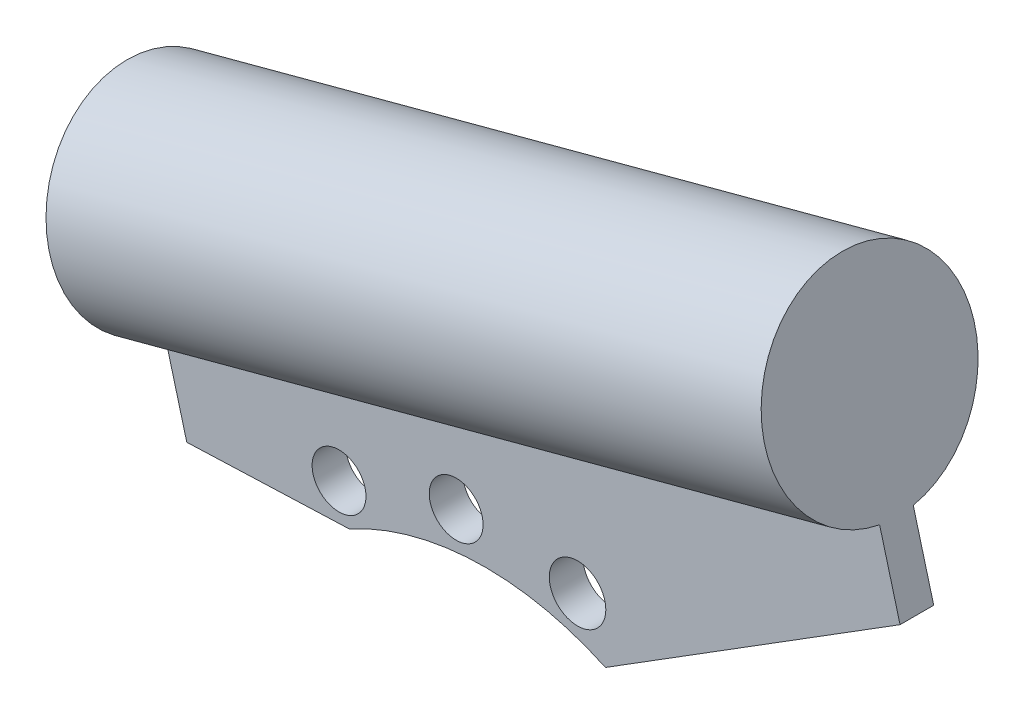
from build123d import *

# Parameters (mm, degrees)
SKETCH1_R           = 4
SKETCH1_R_2         = 4.198873956
BOSS_EXTRUDE1_DEPTH = 5
SKETCH2_R           = 13.5
BOSS_EXTRUDE2_DEPTH = 106
BOSS_EXTRUDE4_DEPTH = 4
CUT_EXTRUDE1_START  = -10
CUT_EXTRUDE1_DEPTH  = 10


with BuildPart() as part:
    # Sketch1 → Boss-Extrude1 (new body)
    with BuildSketch(Plane.XY.offset(32.670544835)):
        with BuildLine():
            Line((-70.496842865, 21.117824566), (-77.080259334, 45.687469315))
            Line((-77.080259334, 45.687469315), (29.171581558, 74.157564276))
            Line((29.171581558, 74.157564276), (32.157340999, 63.014558343))
            Line((32.157340999, 63.014558343), (-11.6122935, 35.626592223))
            ThreePointArc((-11.6122935, 35.626592223), (-40.615747818, 38.096615543), (-64.259394629, 21.117824566))
            Line((-64.259394629, 21.117824566), (-70.496842865, 21.117824566))
        make_face()
        with Locations((-65.433540443, 28.621355152)):
            Circle(SKETCH1_R, mode=Mode.SUBTRACT)
        with Locations((-51.195341682, 39.839935825)):
            Circle(SKETCH1_R, mode=Mode.SUBTRACT)
        with Locations((-33.791359384, 44.907899562)):
            Circle(SKETCH1_R, mode=Mode.SUBTRACT)
        with Locations((-15.756175362, 43.087187195)):
            Circle(SKETCH1_R_2, mode=Mode.SUBTRACT)
    extrude(amount=BOSS_EXTRUDE1_DEPTH)

    # Sketch2 → Boss-Extrude2 (add)
    with BuildSketch(Plane(origin=(-60.494993695, -16.209584707, 0), x_dir=(0, 0, 1), z_dir=(-0.9659258262890686, -0.2588190451025196, 0))):
        with BuildLine():
            Line((37.670544835, 64.080545666), (37.670544835, 64.282169128))
            ThreePointArc((37.670544835, 64.282169128), (35.170544835, 95.280545666), (32.670544835, 64.282169128))
            Line((32.670544835, 64.282169128), (32.670544835, 64.080545666))
            Line((32.670544835, 64.080545666), (37.670544835, 64.080545666))
        make_face()
        with Locations(Location((35.170544835, 79.680545666, 0), (0, 0, 270))):
            Circle(SKETCH2_R, mode=Mode.SUBTRACT)
    extrude(amount=-BOSS_EXTRUDE2_DEPTH)

    # Sketch3 → Boss-Extrude4 (add)
    with BuildSketch(Plane(origin=(41.893143892, 11.225234074, 0), x_dir=(0, 0, -1), z_dir=(0.9659258262890686, 0.2588190451025196, 0))):
        with BuildLine():
            Line((-37.670544835, 64.282169128), (-37.670544835, 64.080545666))
            Line((-37.670544835, 64.080545666), (-32.670544835, 64.080545666))
            Line((-32.670544835, 64.080545666), (-32.670544835, 64.282169128))
            ThreePointArc((-32.670544835, 64.282169128), (-35.170544835, 95.280545666), (-37.670544835, 64.282169128))
        make_face()
    extrude(amount=BOSS_EXTRUDE4_DEPTH)

    # Sketch4 → Cut-Extrude1 (cut)
    with BuildSketch(Plane.XY.offset(37.670544835).offset(CUT_EXTRUDE1_START)):
        with BuildLine():
            Line((-73.814643096, 33.500023595), (-49.675245154, 34.41948085))
            ThreePointArc((-49.675245154, 34.41948085), (-57.759852218, 28.637597873), (-64.259394629, 21.117824566))
            Line((-64.259394629, 21.117824566), (-70.496842865, 21.117824566))
            Line((-70.496842865, 21.117824566), (-73.814643096, 33.500023595))
        make_face()
    extrude(amount=CUT_EXTRUDE1_DEPTH, mode=Mode.SUBTRACT)


solid = part.part
